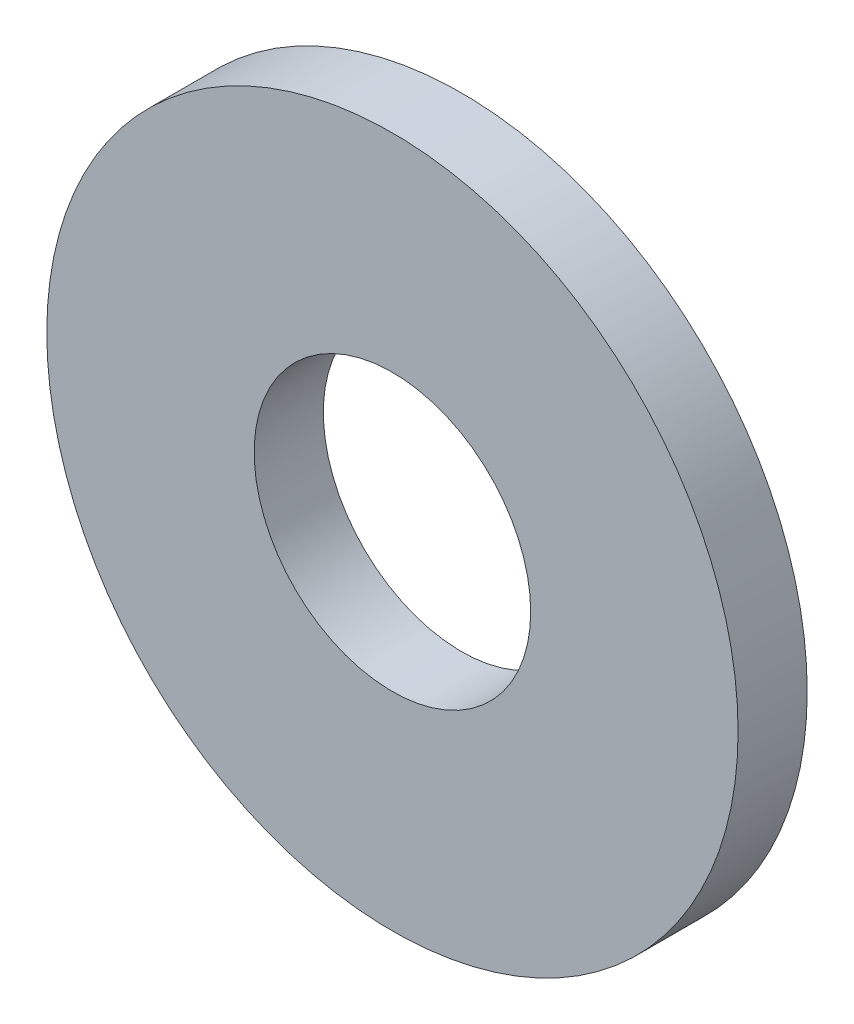
from build123d import *

# Parameters (mm, degrees)
SKETCH1_R      = 7.9375
SKETCH1_R_2    = 3.175
EXTRUDE1_DEPTH = 0.79375


with BuildPart() as part:
    # Sketch1 → Extrude1 (new, symmetric)
    with BuildSketch(Plane.XY):
        Circle(SKETCH1_R)
        Circle(SKETCH1_R_2, mode=Mode.SUBTRACT)
    extrude(amount=EXTRUDE1_DEPTH, both=True)


solid = part.part
